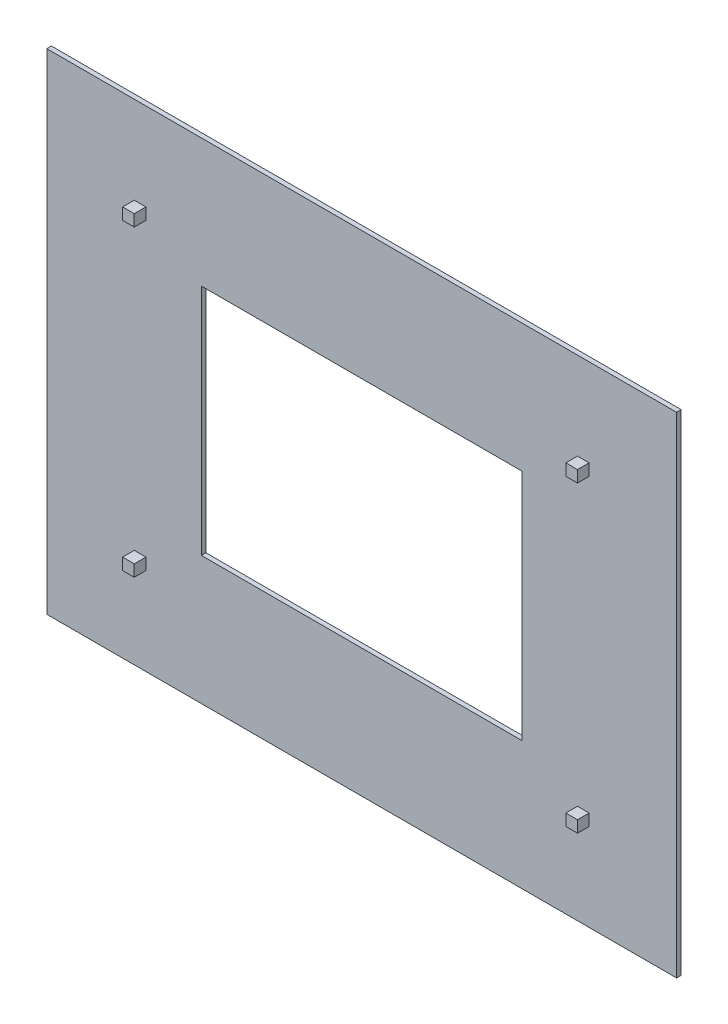
from build123d import *

# Parameters (mm, degrees)
SKETCH1_W           = 137.16
SKETCH1_H           = 106.68
BOSS_EXTRUDE1_DEPTH = 1
SKETCH4_W           = 2.54
SKETCH4_H           = 2.54
BOSS_EXTRUDE2_DEPTH = 2.54
SKETCH5_W           = 69.85
SKETCH5_H           = 50.8
CUT_EXTRUDE1_DEPTH  = 2.54


with BuildPart() as part:
    # Sketch1 → Boss-Extrude1 (new body)
    with BuildSketch(Plane.XY):
        Rectangle(SKETCH1_W, SKETCH1_H)
    extrude(amount=BOSS_EXTRUDE1_DEPTH)

    # Sketch4 → Boss-Extrude2 (add)
    with BuildSketch(Plane.XY.offset(1)):
        with Locations((-48.26, 33.02)):
            Rectangle(SKETCH4_W, SKETCH4_H)
        with Locations((48.26, 33.02)):
            Rectangle(SKETCH4_W, SKETCH4_H)
        with Locations((48.26, -33.02)):
            Rectangle(SKETCH4_W, SKETCH4_H)
        with Locations((-48.26, -33.02)):
            Rectangle(SKETCH4_W, SKETCH4_H)
    extrude(amount=BOSS_EXTRUDE2_DEPTH)

    # Sketch5 → Cut-Extrude1 (cut)
    with BuildSketch(Plane.XY.offset(1)):
        Rectangle(SKETCH5_W, SKETCH5_H)
    extrude(amount=-CUT_EXTRUDE1_DEPTH, mode=Mode.SUBTRACT)


solid = part.part
